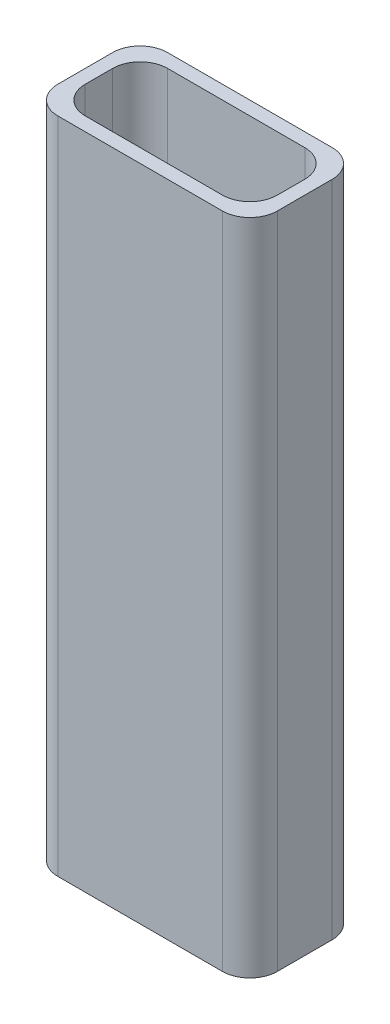
from build123d import *

# Parameters (mm, degrees)
BOSS_EXTRUDE2_DEPTH = 60
CUT_EXTRUDE2_DEPTH  = 123.065556157


with BuildPart() as part:
    # Sketch1 → Boss-Extrude2 (new, symmetric)
    with BuildSketch(Plane(origin=(0, 0, 0), x_dir=(1, 0, 0), z_dir=(0, 1, 0))):
        with BuildLine():
            Line((15, -10), (-15, -10))
            ThreePointArc((-15, -10), (-18.535533906, -8.535533906), (-20, -5))
            Line((-20, -5), (-20, 5))
            ThreePointArc((-20, 5), (-18.535533906, 8.535533906), (-15, 10))
            Line((-15, 10), (15, 10))
            ThreePointArc((15, 10), (18.535533906, 8.535533906), (20, 5))
            Line((20, 5), (20, -5))
            ThreePointArc((20, -5), (18.535533906, -8.535533906), (15, -10))
        make_face()
    extrude(amount=BOSS_EXTRUDE2_DEPTH, both=True)

    # Sketch3 → Cut-Extrude2 (cut, through all)
    with BuildSketch(Plane(origin=(0, 60, 0), x_dir=(1, 0, 0), z_dir=(0, 1, 0))):
        with BuildLine():
            Line((12.5, -7.5), (-12.5, -7.5))
            ThreePointArc((-12.5, -7.5), (-16.035533906, -6.035533906), (-17.5, -2.5))
            Line((-17.5, -2.5), (-17.5, 2.5))
            ThreePointArc((-17.5, 2.5), (-16.035533906, 6.035533906), (-12.5, 7.5))
            Line((-12.5, 7.5), (12.5, 7.5))
            ThreePointArc((12.5, 7.5), (16.035533906, 6.035533906), (17.5, 2.5))
            Line((17.5, 2.5), (17.5, -2.5))
            ThreePointArc((17.5, -2.5), (16.035533906, -6.035533906), (12.5, -7.5))
        make_face()
    extrude(amount=-CUT_EXTRUDE2_DEPTH, mode=Mode.SUBTRACT)


solid = part.part
